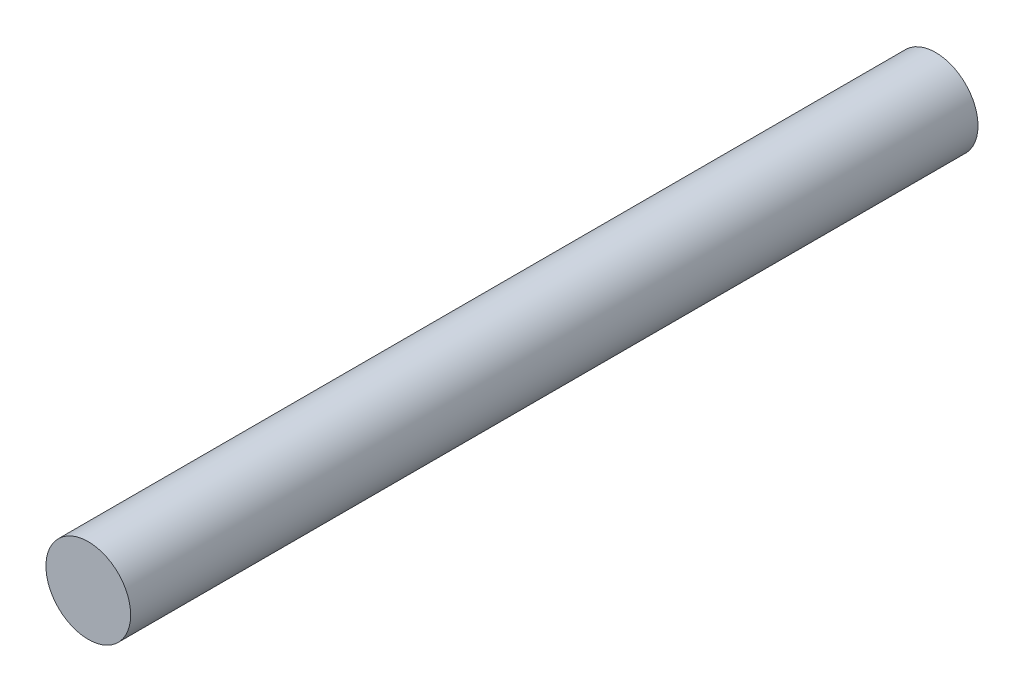
from build123d import *

# Parameters (mm, degrees)
SKETCH1_R           = 5
BOSS_EXTRUDE1_DEPTH = 100


with BuildPart() as part:
    # Sketch1 → Boss-Extrude1 (new body)
    with BuildSketch(Plane.XY):
        Circle(SKETCH1_R)
    extrude(amount=BOSS_EXTRUDE1_DEPTH)


solid = part.part
